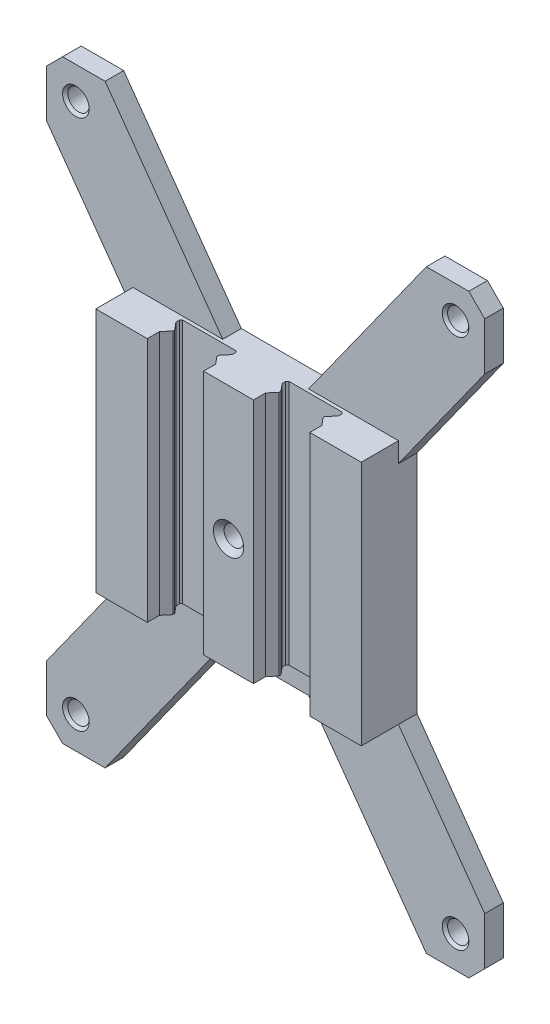
from build123d import *

# Parameters (mm, degrees)
SKICA1_W                     = 50
SKICA1_H                     = 50
P_IDAT_VYSUNUT_M1_DEPTH      = 10
ODEBRAT_VYSUNUT_M2_DEPTH     = 57.789083458
P_IDAT_VYSUNUT_M4_DEPTH      = 1
P_IDAT_VYSUNUT_M4_DEPTH_BACK = 2.5
SKICA4_R                     = 2
SKICA4_W                     = 50
SKICA4_H                     = 50
SKICA6_R                     = 1.85
ODEBRAT_VYSUNUT_M3_DEPTH     = 71.416176377
SKICA7_W                     = 50
SKICA7_H                     = 1
ODEBRAT_VYSUNUT_M4_DEPTH     = 92.446366224
SKICA9_W                     = 6.5
SKICA9_H                     = 3.727272727
ODEBRAT_VYSUNUT_M6_DEPTH     = 88.211595424
ZKOSEN_2_SIZE                = 0.5
P_IDAT_START                 = 0.5
SKICA10_W                    = 9.4
SKICA10_H                    = 46.272727273
SKICA10_R                    = 1.85
SKICA10_W_2                  = 9.7
P_IDAT_VYSUNUT_M5_DEPTH      = 0.5
ZKOSEN_3_SIZE                = 1


with BuildPart() as part:
    # Skica1 → Přidat vysunutím1 (new body)
    with BuildSketch(Plane.XY):
        Rectangle(SKICA1_W, SKICA1_H)
    extrude(amount=P_IDAT_VYSUNUT_M1_DEPTH)

    # Skica3 → Odebrat vysunutím2 (cut, through all)
    with BuildSketch(Plane(origin=(0, 25, 0), x_dir=(1, 0, 0), z_dir=(0, 1, 0))):
        Polygon((-15.3, -10), (-15.3, -7.22080893), (-14.133651513, -5.83080893), (-14.133651513, -5.49919107), (-15.3, -4.10919107), (-15.3, -3.430543964), (-14.999456036, -3.13), (-5.000543964, -3.13), (-4.7, -3.430543964), (-4.7, -4.10919107), (-5.866348487, -5.49919107), (-5.866348487, -5.83080893), (-4.7, -7.22080893), (-4.7, -10), align=None)
        Polygon((15.3, -3.430543964), (14.999456036, -3.13), (5.000543964, -3.13), (4.7, -3.430543964), (4.7, -4.10919107), (5.866348487, -5.49919107), (5.866348487, -5.83080893), (4.7, -7.22080893), (4.7, -10), (15.3, -10), (15.3, -7.22080893), (14.133651513, -5.83080893), (14.133651513, -5.49919107), (15.3, -4.10919107), align=None)
    extrude(amount=-ODEBRAT_VYSUNUT_M2_DEPTH, mode=Mode.SUBTRACT)

    # Skica4 → Přidat vysunutím4 (add, two sides: drawn at the far end of the back side and taken through both)
    # profile 1 of 5: a face of its own
    with BuildSketch(Plane(origin=(0, 0, 0), x_dir=(-1, 0, 0), z_dir=(0, 0, -1)).offset(-P_IDAT_VYSUNUT_M4_DEPTH_BACK)):
        Polygon((-30.25, -56), (-8.085, -25), (-25, -25), (-25, -21.272727273), (-41.248489616, -43.997887574), (-41.248489616, -46.002224154), (-41.248489616, -53.002224154), (-38.25, -56), align=None)
        with Locations((-35.75, -50)):
            Circle(SKICA4_R, mode=Mode.SUBTRACT)
    # profile 2 of 5: a face of its own
    with BuildSketch(Plane(origin=(0, 0, 0), x_dir=(-1, 0, 0), z_dir=(0, 0, -1)).offset(-P_IDAT_VYSUNUT_M4_DEPTH_BACK)):
        Rectangle(SKICA4_W, SKICA4_H)
    # profile 3 of 5: a face of its own
    with BuildSketch(Plane(origin=(0, 0, 0), x_dir=(-1, 0, 0), z_dir=(0, 0, -1)).offset(-P_IDAT_VYSUNUT_M4_DEPTH_BACK)):
        Polygon((-25, 25), (-8.085, 25), (-30.25, 56), (-38.25, 56), (-41.248489616, 53.002224154), (-41.248489616, 46.002224154), (-41.248489616, 43.997887574), (-25, 21.272727273), align=None)
        with Locations((-35.75, 50)):
            Circle(SKICA4_R, mode=Mode.SUBTRACT)
    # profile 4 of 5: a face of its own
    with BuildSketch(Plane(origin=(0, 0, 0), x_dir=(-1, 0, 0), z_dir=(0, 0, -1)).offset(-P_IDAT_VYSUNUT_M4_DEPTH_BACK)):
        Polygon((41.248489616, 46.002224154), (41.248489616, 53.002224154), (38.25, 56), (30.25, 56), (8.085, 25), (25, 25), (25, 21.272727273), (41.248489616, 43.997887574), align=None)
        with Locations((35.75, 50)):
            Circle(SKICA4_R, mode=Mode.SUBTRACT)
    # profile 5 of 5: a face of its own
    with BuildSketch(Plane(origin=(0, 0, 0), x_dir=(-1, 0, 0), z_dir=(0, 0, -1)).offset(-P_IDAT_VYSUNUT_M4_DEPTH_BACK)):
        Polygon((41.248489616, -43.997887574), (25, -21.272727273), (25, -25), (8.085, -25), (30.25, -56), (38.25, -56), (41.248489616, -53.002224154), (41.248489616, -46.002224154), align=None)
        with Locations((35.75, -50)):
            Circle(SKICA4_R, mode=Mode.SUBTRACT)
    extrude(amount=P_IDAT_VYSUNUT_M4_DEPTH + P_IDAT_VYSUNUT_M4_DEPTH_BACK)

    # Skica6 → Odebrat vysunutím3 (cut, through all)
    with BuildSketch(Plane.XY.offset(10)):
        Circle(SKICA6_R)
    extrude(amount=-ODEBRAT_VYSUNUT_M3_DEPTH, mode=Mode.SUBTRACT)

    # Skica7 → Odebrat vysunutím4 (cut, through all)
    with BuildSketch(Plane(origin=(0, 25, 0), x_dir=(1, 0, 0), z_dir=(0, 1, 0))):
        with Locations((0, -9.5)):
            Rectangle(SKICA7_W, SKICA7_H)
    extrude(amount=-ODEBRAT_VYSUNUT_M4_DEPTH, mode=Mode.SUBTRACT)

    # Skica9 → Odebrat vysunutím6 (cut, through all)
    with BuildSketch(Plane(origin=(25, 0, 0), x_dir=(0, 0, -1), z_dir=(1, 0, 0))):
        with Locations((-5.75, -23.136363637)):
            Rectangle(SKICA9_W, SKICA9_H)
    extrude(amount=-ODEBRAT_VYSUNUT_M6_DEPTH, mode=Mode.SUBTRACT)

    # Zkosení2
    zkosen_2_edges = [part.edges().sort_by_distance(p)[0] for p in [
        (-33.75, 50, 2.5),
        (37.75, -50, 2.5),
        (-33.75, -50, 2.5),
        (37.75, 50, 2.5),
    ]]
    chamfer(zkosen_2_edges, length=ZKOSEN_2_SIZE)

    # Skica10 → Přidat vysunutím5 (add)
    # profile 1 of 3: a face of its own
    with BuildSketch(Plane.XY.offset(9).offset(P_IDAT_START)):
        with Locations((0, 1.863636363)):
            Rectangle(SKICA10_W, SKICA10_H)
        Circle(SKICA10_R, mode=Mode.SUBTRACT)
    # profile 2 of 3: a face of its own
    with BuildSketch(Plane.XY.offset(9).offset(P_IDAT_START)):
        with Locations((-20.15, 1.863636363)):
            Rectangle(SKICA10_W_2, SKICA10_H)
    # profile 3 of 3: a face of its own
    with BuildSketch(Plane.XY.offset(9).offset(P_IDAT_START)):
        with Locations((20.15, 1.863636363)):
            Rectangle(SKICA10_W_2, SKICA10_H)
    extrude(amount=-P_IDAT_VYSUNUT_M5_DEPTH)

    # Zkosení3
    zkosen_3_edges = [part.edges().sort_by_distance(p)[0] for p in [
        (-1.85, 0, 9.5),
    ]]
    chamfer(zkosen_3_edges, length=ZKOSEN_3_SIZE)


solid = part.part
